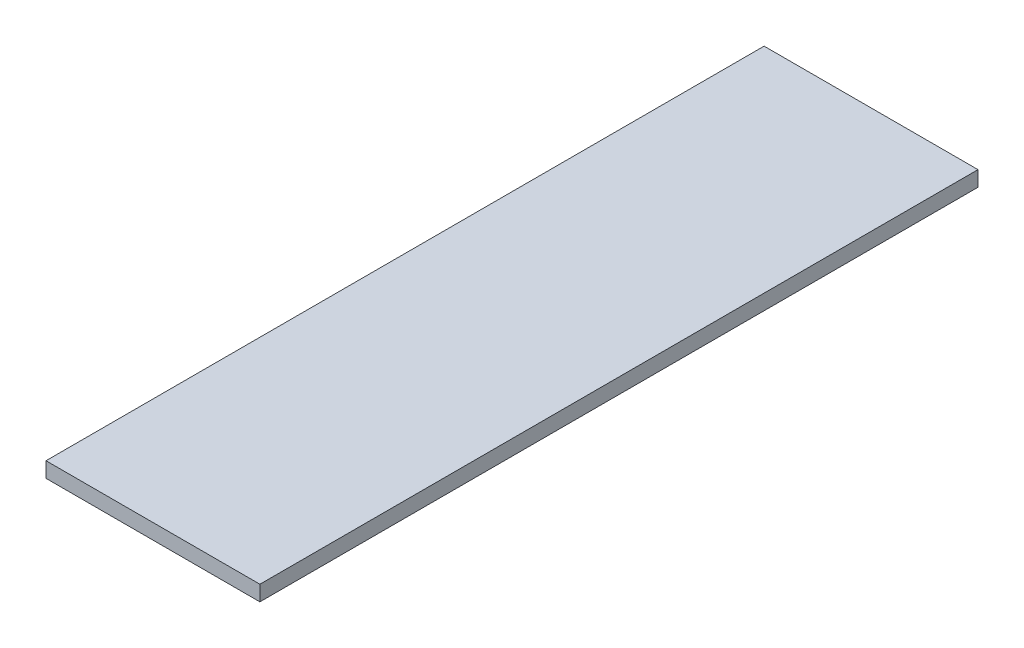
from build123d import *

# Parameters (mm, degrees)
SKETCH_1_W      = 2100
SKETCH_1_H      = 7050
EXTRUDE_1_DEPTH = 150


with BuildPart() as part:
    # Эскиз1 → Бобышка-Вытянуть1 (new body)
    with BuildSketch(Plane(origin=(0, 0, 0), x_dir=(1, 0, 0), z_dir=(0, 1, 0))):
        with Locations((0, -3375)):
            Rectangle(SKETCH_1_W, SKETCH_1_H)
    extrude(amount=-EXTRUDE_1_DEPTH)


solid = part.part
